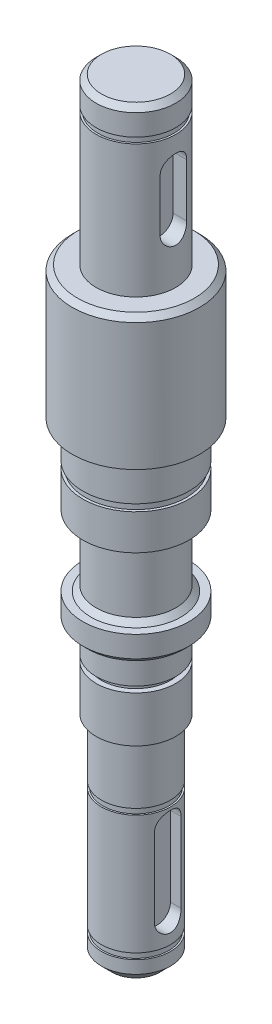
from build123d import *

# Parameters (mm, degrees)
SFAZOWANIE2_SIZE           = 1
WYTNIJ_WYCI_GNI_CIE1_DEPTH = 5.5
WYTNIJ_WYCI_GNI_CIE2_DEPTH = 6
SFAZOWANIE3_SIZE           = 2


with BuildPart() as part:
    # Szkic1 → Obrót1 (revolve)
    with BuildSketch(Plane(origin=(0, 0, 0), x_dir=(0, 0, -1), z_dir=(1, 0, 0))):
        Polygon((-3, -6.188308688), (-3, 99.409284105), (-10.5, 99.409284105), (-10.5, 94.409284105), (-10.15, 94.409284105), (-10.15, 93.309284105), (-10.5, 93.309284105), (-10.5, 68.309284105), (-15, 68.309284105), (-15, 43.309284105), (-13, 43.309284105), (-13, 36.309284105), (-12.5, 36.309284105), (-12.5, 35.009284105), (-13, 35.009284105), (-13, 28.309284105), (-10.5, 28.309284105), (-10.5, 15), (-13, 15), (-13, 10), (-10.5, 10), (-10.5, 4.778207376), (-9.5, 4.778207376), (-9.5, 3.660040364), (-10.5, 3.660040364), (-10.5, -5), (-9.5, -5), (-9.5, -15.9), (-9.2, -15.9), (-9.2, -17), (-9.5, -17), (-9.5, -39.5), (-9.2, -39.5), (-9.2, -40.6), (-9.5, -40.6), (-9.5, -45), (-3, -45), (-3, -6.690715895), align=None)
    revolve(axis=Axis((0, 99.409284105, 3), (0, -1, 0)))

    # Sfazowanie2
    sfazowanie2_edges = [part.edges().sort_by_distance(p)[0] for p in [
        (0, 10, -7),
        (0, 15, -4.5),
        (0, 28.309284105, -4.5),
        (0, 68.309284105, -9),
        (0, 99.409284105, -4.5),
    ]]
    chamfer(sfazowanie2_edges, length=SFAZOWANIE2_SIZE)

    # Szkic2 → Wytnij-wyciągnięcie1 (cut)
    with BuildSketch(Plane(origin=(10, 0, 0), x_dir=(0, 0, -1), z_dir=(1, 0, 0))):
        with BuildLine():
            Line((-0.5, 87.721044176), (-0.5, 77.721044176))
            ThreePointArc((-0.5, 77.721044176), (-3, 75.221044176), (-5.5, 77.721044176))
            Line((-5.5, 77.721044176), (-5.5, 87.721044176))
            ThreePointArc((-5.5, 87.721044176), (-3, 90.221044176), (-0.5, 87.721044176))
        make_face()
    extrude(amount=-WYTNIJ_WYCI_GNI_CIE1_DEPTH, mode=Mode.SUBTRACT)

    # Szkic2<4> → Wytnij-wyciągnięcie2 (cut)
    with BuildSketch(Plane(origin=(10, 0, 0), x_dir=(0, 0, -1), z_dir=(1, 0, 0))):
        with BuildLine():
            Line((-5.5, -20.047619848), (-5.5, -35.047619848))
            ThreePointArc((-5.5, -35.047619848), (-3, -37.547619848), (-0.5, -35.047619848))
            Line((-0.5, -35.047619848), (-0.5, -20.047619848))
            ThreePointArc((-0.5, -20.047619848), (-3, -17.547619848), (-5.5, -20.047619848))
        make_face()
    extrude(amount=-WYTNIJ_WYCI_GNI_CIE2_DEPTH, mode=Mode.SUBTRACT)

    # Sfazowanie3
    sfazowanie3_edges = [part.edges().sort_by_distance(p)[0] for p in [
        (0, -45, -3.5),
    ]]
    chamfer(sfazowanie3_edges, length=SFAZOWANIE3_SIZE)


solid = part.part
